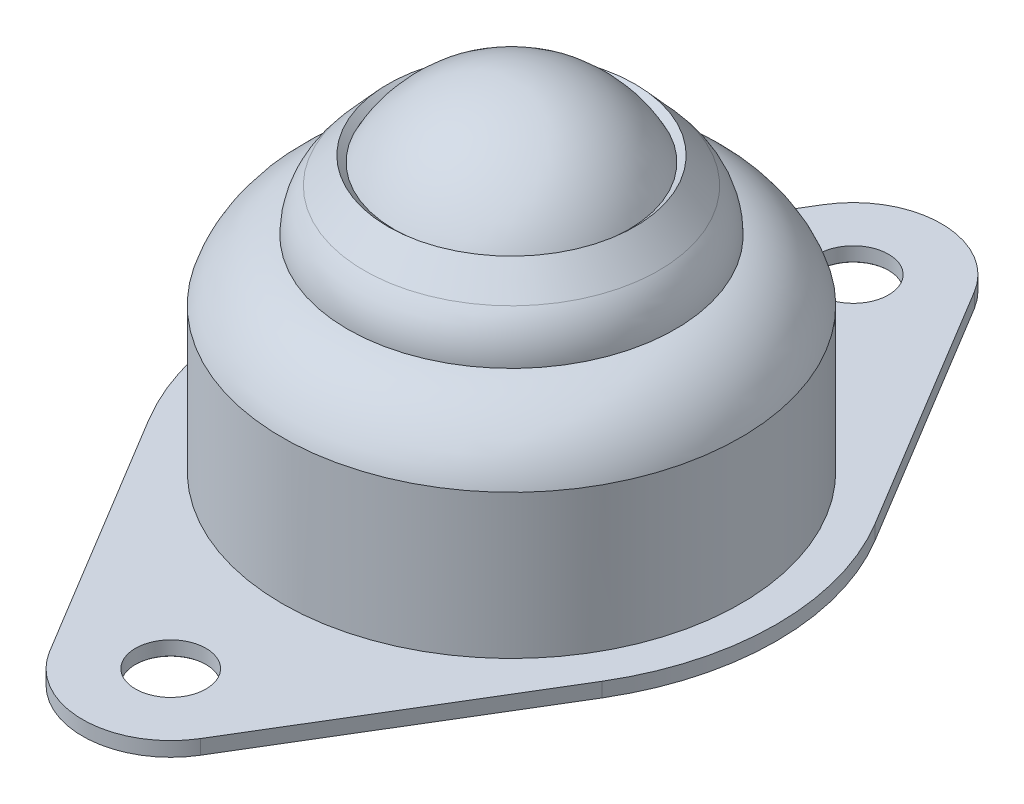
from build123d import *

# Parameters (mm, degrees)
BASE_DEPTH                     = 0.82
F_4_0MM_DOWEL_HOLE1_AT_2_COUNT = 2
F_4_0MM_DOWEL_HOLE1_AT_2_PITCH = 38.7


with BuildPart() as part:
    # Sketch1 → base (new body)
    with BuildSketch(Plane(origin=(0, 0, 0), x_dir=(1, 0, 0), z_dir=(0, 1, 0))):
        with BuildLine():
            Line((-4.25154814, 21.933979328), (-12.812634714, 7.751937984))
            ThreePointArc((-12.812634714, 7.751937984), (-14.971004853, 0), (-12.812634714, -7.751937984))
            Line((-12.812634714, -7.751937984), (-4.25154814, -21.933979328))
            ThreePointArc((-4.25154814, -21.933979328), (0.028995147, -24.35), (4.309538434, -21.933979328))
            Line((4.309538434, -21.933979328), (12.870625008, -7.751937984))
            ThreePointArc((12.870625008, -7.751937984), (15.028995147, 0), (12.870625008, 7.751937984))
            Line((12.870625008, 7.751937984), (4.309538434, 21.933979328))
            ThreePointArc((4.309538434, 21.933979328), (0.028995147, 24.35), (-4.25154814, 21.933979328))
        make_face()
    extrude(amount=BASE_DEPTH)

    # Sketch7 → Ø4.0mm Dowel Hole1 (revolve, cut)
    with BuildSketch(Plane(origin=(0.028995147, 0, 19.35), x_dir=(0, 0, -1), z_dir=(1, 0, 0))):
        Polygon((0, 0), (0, 0.82), (2, 0.82), (2, 0.025), (2.025, 0), align=None)
    f_4_0mm_dowel_hole1 = revolve(axis=Axis((0.028995147, -6.35, 19.35), (0, 1, 0)), mode=Mode.SUBTRACT)

    # Ø4.0mm Dowel Hole1 at 2: Ø4.0mm Dowel Hole1 ×2
    with Locations(*[(0, 0, -i * F_4_0MM_DOWEL_HOLE1_AT_2_PITCH) for i in range(1, F_4_0MM_DOWEL_HOLE1_AT_2_COUNT)]):
        add(f_4_0mm_dowel_hole1, mode=Mode.SUBTRACT)



with BuildPart() as body_2:
    # Sketch3 → ball (revolve)
    with BuildSketch(Plane(origin=(0, 0, 0), x_dir=(0, 0, -1), z_dir=(1, 0, 0))):
        with BuildLine():
            Line((0, 20), (0, 5))
            ThreePointArc((0, 5), (7.5, 12.5), (0, 20))
        make_face()
    revolve(axis=Axis((0, 0, 0), (0, 1, 0)))


with BuildPart() as part_1:
    add(part.part)

    add(body_2.part)  # ball-casing merges body 2
    # Sketch5 → ball-casing (revolve)
    with BuildSketch(Plane.XY, mode=Mode.PRIVATE) as ball_casing_sk:
        with BuildLine():
            Line((12.5, 0.82), (12.5, 8.899377385))
            ThreePointArc((12.5, 8.899377385), (11.08045669, 10.994211459), (8.772378447, 12.031615828))
            ThreePointArc((8.772378447, 12.031615828), (8.640244739, 13.357018823), (7.975716367, 14.511382049))
            Line((7.975716367, 14.511382049), (6.633249581, 16))
            Line((6.633249581, 16), (7.004560273, 16.334855744))
            Line((7.004560273, 16.334855744), (8.34702706, 14.846237794))
            ThreePointArc((8.34702706, 14.846237794), (9.038134101, 13.729107064), (9.291907773, 12.44022812))
            ThreePointArc((9.291907773, 12.44022812), (11.603302205, 11.198772196), (13, 8.977738136))
            Line((13, 8.977738136), (13, 0.82))
            Line((13, 0.82), (12.5, 0.82))
        make_face()
    revolve(ball_casing_sk.sketch.rotate(Axis((0, 0, 0), (0, 1, 0)), 90), axis=Axis((0, 0, 0), (0, 1, 0)))


solid = part_1.part
